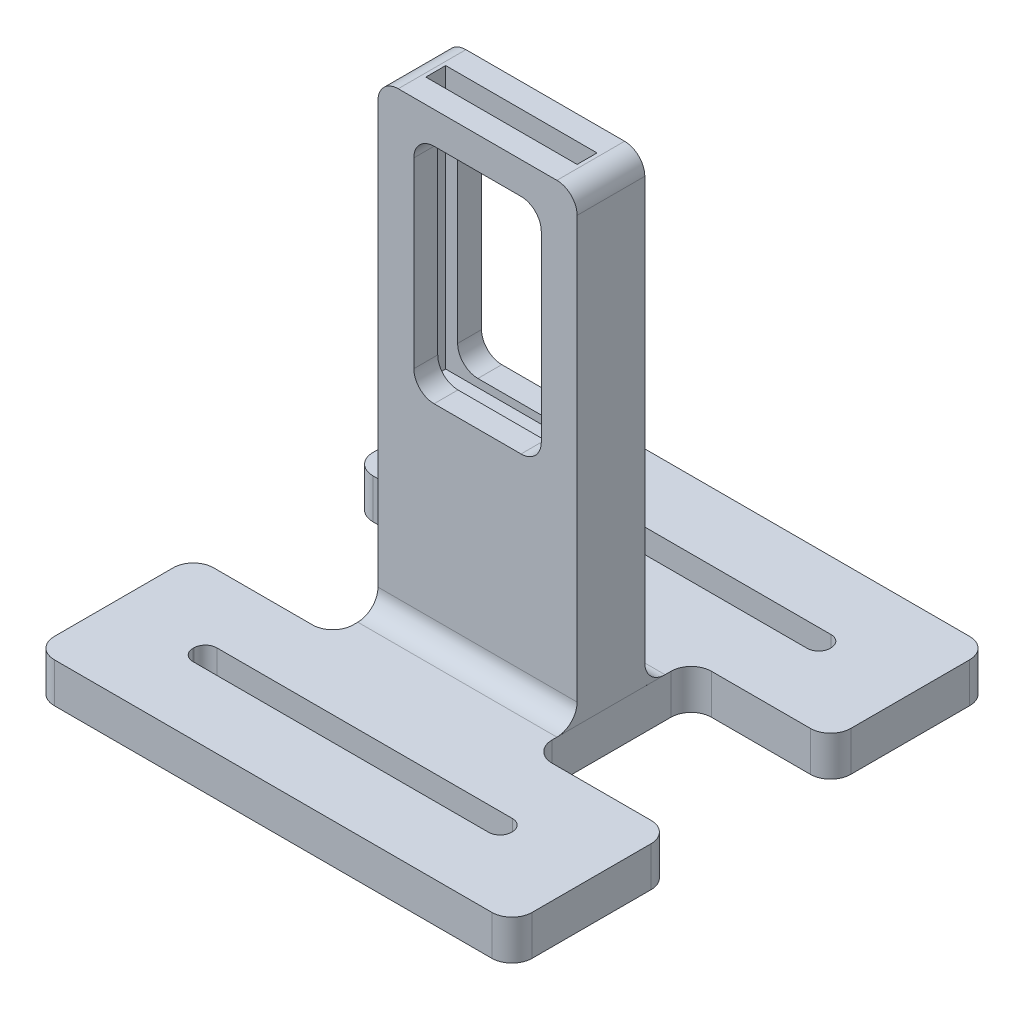
from build123d import *

# Parameters (mm, degrees)
BOSS_EXTRUDE1_DEPTH = 5
CUT_EXTRUDE1_DEPTH  = 43.772012023
FILLET1_R           = 2.54
SKETCH3_W           = 25
SKETCH3_H           = 8.5
BOSS_EXTRUDE2_DEPTH = 25
SKETCH4_W           = 3
SKETCH4_H           = 2.5
BOSS_EXTRUDE3_DEPTH = 33
CUT_EXTRUDE2_DEPTH  = 78.698440822
FILLET2_R           = 2.54


with BuildPart() as part:
    # Sketch1 → Boss-Extrude1 (new body)
    with BuildSketch(Plane(origin=(0, 0, 0), x_dir=(1, 0, 0), z_dir=(0, 1, 0))):
        Polygon((-29.999623956, -29.926382831), (30.000376044, -29.926382831), (30.000376044, -9.926382831), (12.500376044, -9.926382831), (12.500376044, 10.073617169), (30.000376044, 10.073617169), (30.000376044, 30.073617169), (-29.999623956, 30.073617169), (-29.999623956, 10.073617169), (-12.499623956, 10.073617169), (-12.499623956, -9.926382831), (-29.999623956, -9.926382831), align=None)
    extrude(amount=BOSS_EXTRUDE1_DEPTH)

    # Sketch2 → Cut-Extrude1 (cut, through all)
    with BuildSketch(Plane(origin=(0, 5, 0), x_dir=(1, 0, 0), z_dir=(0, 1, 0))):
        with BuildLine():
            Line((-18.549247911, 18.573617169), (18.55, 18.573617169))
            ThreePointArc((18.55, 18.573617169), (19.575304833, 18.998312337), (20, 20.023617169))
            Line((20, 20.023617169), (20, 20.123617169))
            ThreePointArc((20, 20.123617169), (19.575304833, 21.148922002), (18.55, 21.573617169))
            Line((18.55, 21.573617169), (-18.549247911, 21.573617169))
            ThreePointArc((-18.549247911, 21.573617169), (-19.574552744, 21.148922002), (-19.999247911, 20.123617169))
            Line((-19.999247911, 20.123617169), (-19.999247911, 20.023617169))
            ThreePointArc((-19.999247911, 20.023617169), (-19.574552744, 18.998312337), (-18.549247911, 18.573617169))
        make_face()
        with BuildLine():
            Line((-18.549623956, -21.426382831), (18.550376044, -21.426382831))
            ThreePointArc((18.550376044, -21.426382831), (19.575680877, -21.001687663), (20.000376044, -19.976382831))
            Line((20.000376044, -19.976382831), (20.000376044, -19.876382831))
            ThreePointArc((20.000376044, -19.876382831), (19.575680877, -18.851077998), (18.550376044, -18.426382831))
            Line((18.550376044, -18.426382831), (-18.549623956, -18.426382831))
            ThreePointArc((-18.549623956, -18.426382831), (-19.574928788, -18.851077998), (-19.999623956, -19.876382831))
            Line((-19.999623956, -19.876382831), (-19.999623956, -19.976382831))
            ThreePointArc((-19.999623956, -19.976382831), (-19.574928788, -21.001687663), (-18.549623956, -21.426382831))
        make_face()
    extrude(amount=-CUT_EXTRUDE1_DEPTH, mode=Mode.SUBTRACT)

    # Fillet1
    fillet1_edges = [part.edges().sort_by_distance(p)[0] for p in [
        (-29.999623956, 2.5, -10.073617169),
        (-29.999623956, 2.5, -30.073617169),
        (30.000376044, 2.5, -30.073617169),
        (30.000376044, 2.5, -10.073617169),
        (12.500376044, 2.5, -10.073617169),
        (12.500376044, 2.5, 9.926382831),
        (30.000376044, 2.5, 9.926382831),
        (30.000376044, 2.5, 29.926382831),
        (-29.999623956, 2.5, 29.926382831),
        (-29.999623956, 2.5, 9.926382831),
        (-12.499623956, 2.5, 9.926382831),
        (-12.499623956, 2.5, -10.073617169),
    ]]
    fillet(fillet1_edges, radius=FILLET1_R)

    # Sketch3 → Boss-Extrude2 (add)
    with BuildSketch(Plane(origin=(0, 5, 0), x_dir=(1, 0, 0), z_dir=(0, 1, 0))):
        Rectangle(SKETCH3_W, SKETCH3_H)
    extrude(amount=BOSS_EXTRUDE2_DEPTH)

    # Sketch4 → Boss-Extrude3 (add)
    with BuildSketch(Plane(origin=(0, 30, 0), x_dir=(1, 0, 0), z_dir=(0, 1, 0))):
        Polygon((12.5, -4.25), (12.5, -1.25), (9.5, -1.25), (-9.5, -1.25), (-12.5, -1.25), (-12.5, -4.25), align=None)
        with Locations((11, 0)):
            Rectangle(SKETCH4_W, SKETCH4_H)
        Polygon((9.5, 1.25), (12.5, 1.25), (12.5, 4.25), (-12.5, 4.25), (-12.5, 1.25), (-9.5, 1.25), align=None)
        with Locations((-11, 0)):
            Rectangle(SKETCH4_W, SKETCH4_H)
    extrude(amount=BOSS_EXTRUDE3_DEPTH)

    # Sketch5 → Cut-Extrude2 (cut, through all)
    with BuildSketch(Plane(origin=(0, 0, -4.25), x_dir=(-1, 0, 0), z_dir=(0, 0, -1))):
        with BuildLine():
            Line((-5.46, 31), (5.46, 31))
            ThreePointArc((5.46, 31), (7.256051224, 31.743948776), (8, 33.54))
            Line((8, 33.54), (8, 56.46))
            ThreePointArc((8, 56.46), (7.256051224, 58.256051224), (5.46, 59))
            Line((5.46, 59), (-5.46, 59))
            ThreePointArc((-5.46, 59), (-7.256051224, 58.256051224), (-8, 56.46))
            Line((-8, 56.46), (-8, 33.54))
            ThreePointArc((-8, 33.54), (-7.256051224, 31.743948776), (-5.46, 31))
        make_face()
    extrude(amount=-CUT_EXTRUDE2_DEPTH, mode=Mode.SUBTRACT)

    # Fillet2
    fillet2_edges = [part.edges().sort_by_distance(p)[0] for p in [
        (0.000188022, 5, 4.25),
        (0.000188022, 5, -4.25),
        (-12.5, 63, 0),
        (12.5, 63, 0),
    ]]
    fillet(fillet2_edges, radius=FILLET2_R)


solid = part.part
